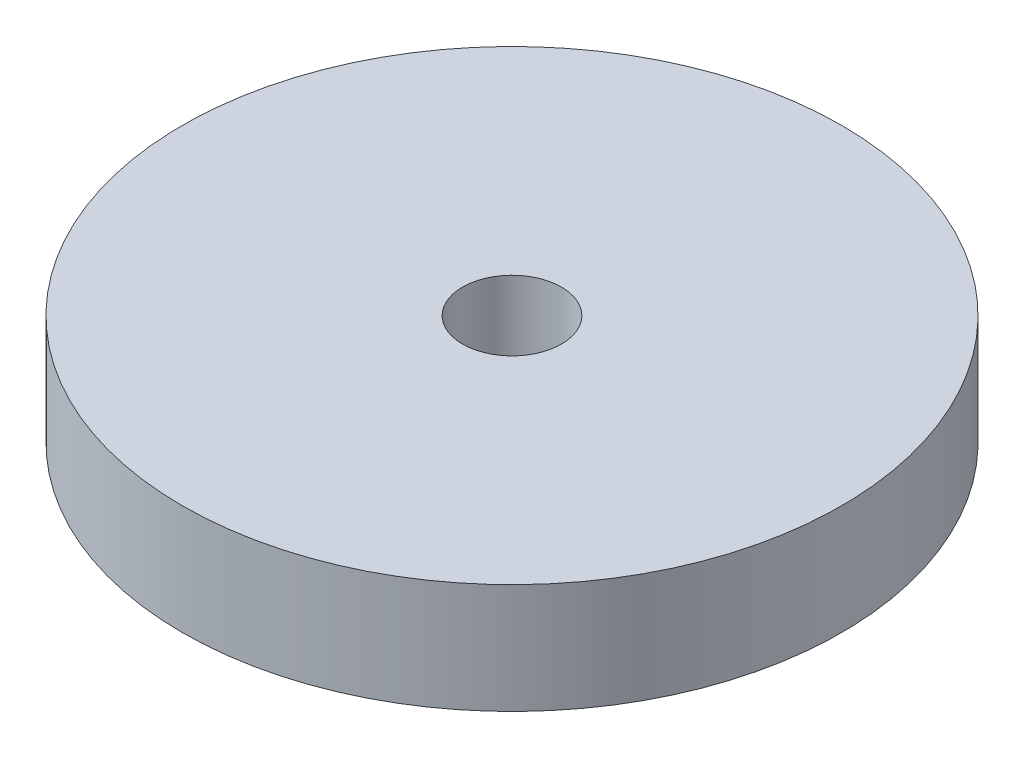
from build123d import *

# Parameters (mm, degrees)
SKETCH1_R           = 6
BOSS_EXTRUDE1_DEPTH = 2
SKETCH2_R           = 0.9
CUT_EXTRUDE1_DEPTH  = 2


with BuildPart() as part:
    # Sketch1 → Boss-Extrude1 (new body)
    with BuildSketch(Plane(origin=(0, 0, 0), x_dir=(1, 0, 0), z_dir=(0, 1, 0))):
        with Locations(Location((27.632966471, -12.893147965, 0), (0, 0, 270))):
            Circle(SKETCH1_R)
    extrude(amount=BOSS_EXTRUDE1_DEPTH)

    # Sketch2 → Cut-Extrude1 (cut)
    with BuildSketch(Plane(origin=(0, 2, 0), x_dir=(1, 0, 0), z_dir=(0, 1, 0))):
        with Locations(Location((27.632966471, -12.893147965, 0), (0, 0, 270))):
            Circle(SKETCH2_R)
    extrude(amount=-CUT_EXTRUDE1_DEPTH, mode=Mode.SUBTRACT)


solid = part.part
